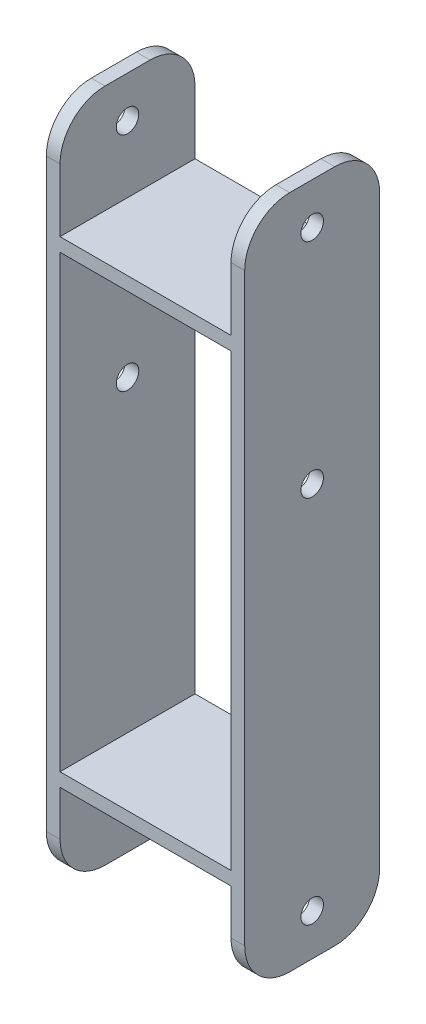
from build123d import *

# Parameters (mm, degrees)
SKETCH1_W           = 3.047619048
SKETCH1_H           = 150
SKETCH1_W_2         = 38
SKETCH1_H_2         = 3
BOSS_EXTRUDE1_DEPTH = 15
FILLET1_R           = 10
SKETCH2_R           = 2.5
CUT_EXTRUDE1_DEPTH  = 61
SKETCH3_R           = 2.5
CUT_EXTRUDE2_DEPTH  = 55


with BuildPart() as part:
    # Sketch1 → Boss-Extrude1 (new, symmetric)
    with BuildSketch(Plane.XY):
        with Locations((-20.523809524, 25)):
            Rectangle(SKETCH1_W, SKETCH1_H)
        with Locations((20.523809524, 25)):
            Rectangle(SKETCH1_W, SKETCH1_H)
        with Locations((0, 74.5)):
            Rectangle(SKETCH1_W_2, SKETCH1_H_2)
        with Locations((0, -28.5)):
            Rectangle(SKETCH1_W_2, SKETCH1_H_2)
    extrude(amount=BOSS_EXTRUDE1_DEPTH, both=True)

    # Fillet1
    fillet1_edges = [part.edges().sort_by_distance(p)[0] for p in [
        (-20.523809524, -50, -15),
        (20.523809524, -50, -15),
        (20.523809524, -50, 15),
        (-20.523809524, -50, 15),
        (-20.523809524, 100, 15),
        (-20.523809524, 100, -15),
        (20.523809524, 100, -15),
        (20.523809524, 100, 15),
    ]]
    fillet(fillet1_edges, radius=FILLET1_R)

    # Sketch2 → Cut-Extrude1 (cut)
    with BuildSketch(Plane(origin=(22.047619048, 0, 0), x_dir=(0, 0, -1), z_dir=(1, 0, 0))):
        with Locations(Location((0, 41.439583657, 0), (0, 0, 90))):
            Circle(SKETCH2_R)
        with Locations(Location((0, -40.747770908, 0), (0, 0, 90))):
            Circle(SKETCH2_R)
    extrude(amount=-CUT_EXTRUDE1_DEPTH, mode=Mode.SUBTRACT)

    # Sketch3 → Cut-Extrude2 (cut)
    with BuildSketch(Plane(origin=(22.047619048, 0, 0), x_dir=(0, 0, -1), z_dir=(1, 0, 0))):
        with Locations(Location((0, 90.824457964, 0), (0, 0, 90))):
            Circle(SKETCH3_R)
    extrude(amount=-CUT_EXTRUDE2_DEPTH, mode=Mode.SUBTRACT)


solid = part.part
